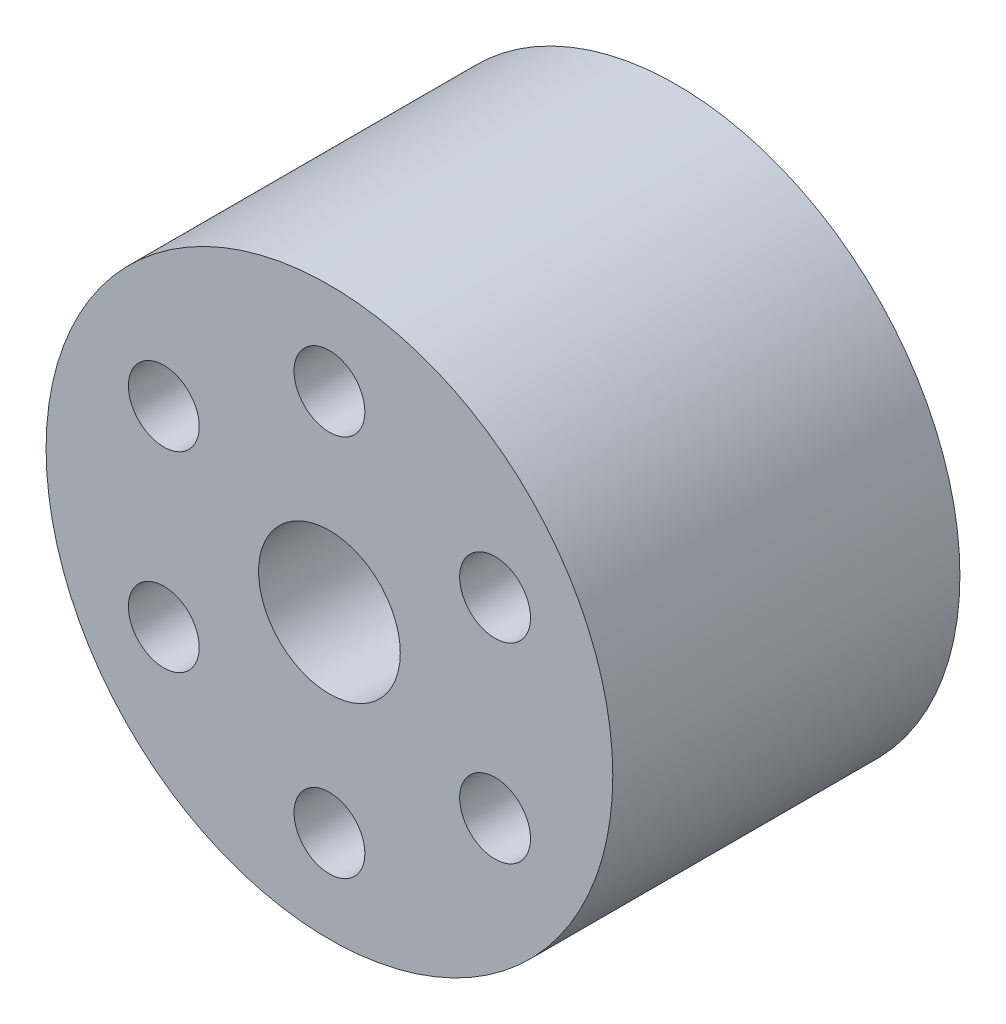
from build123d import *

# Parameters (mm, degrees)
SKETCH_1_R          = 20
EXTRUDE_1_DEPTH     = 24.5
SKETCH_2_R          = 5
CUT_EXTRUDE_1_DEPTH = 10
SKETCH_3_R          = 4
CUT_EXTRUDE_2_DEPTH = 32.784430151
SKETCH_4_R          = 2.5
CUT_EXTRUDE_3_DEPTH = 10


with BuildPart() as part:
    # 스케치1 → 보스-돌출1 (new body)
    with BuildSketch(Plane.XY):
        Circle(SKETCH_1_R)
    extrude(amount=EXTRUDE_1_DEPTH)

    # 스케치2 → 컷-돌출1 (cut)
    with BuildSketch(Plane.XY.offset(24.5)):
        Circle(SKETCH_2_R)
    extrude(amount=-CUT_EXTRUDE_1_DEPTH, mode=Mode.SUBTRACT)

    # 스케치3 → 컷-돌출2 (cut, through all)
    with BuildSketch(Plane.XY.offset(14.5)):
        Circle(SKETCH_3_R)
    extrude(amount=-CUT_EXTRUDE_2_DEPTH, mode=Mode.SUBTRACT)

    # 스케치4 → 컷-돌출3 (cut)
    with BuildSketch(Plane.XY.offset(24.5)):
        with Locations((11.691342951, 6.75)):
            Circle(SKETCH_4_R)
        with Locations((0, 13.5)):
            Circle(SKETCH_4_R)
        with Locations((11.691342951, -6.75)):
            Circle(SKETCH_4_R)
        with Locations((0, -13.5)):
            Circle(SKETCH_4_R)
        with Locations((-11.691342951, -6.75)):
            Circle(SKETCH_4_R)
        with Locations((-11.691342951, 6.75)):
            Circle(SKETCH_4_R)
    extrude(amount=-CUT_EXTRUDE_3_DEPTH, mode=Mode.SUBTRACT)


solid = part.part
